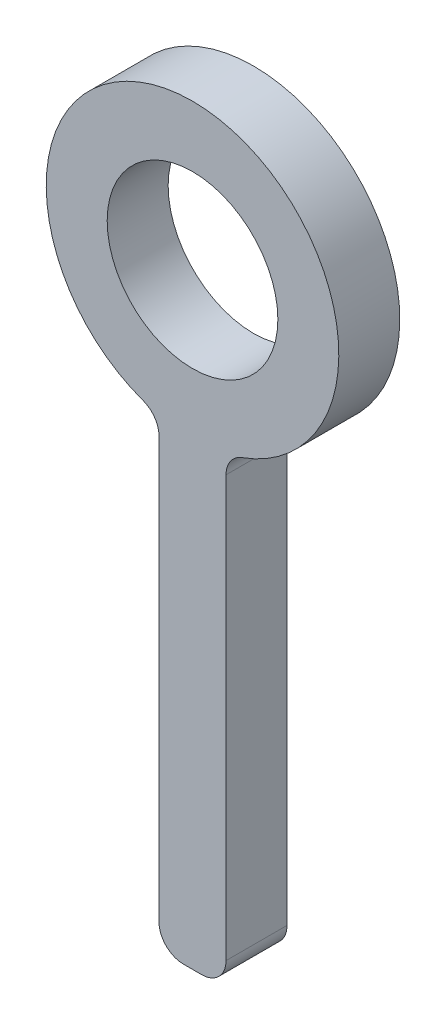
from build123d import *

# Parameters (mm, degrees)
SKETCH1_R           = 7
BOSS_EXTRUDE1_DEPTH = 5
FILLET1_R           = 2


with BuildPart() as part:
    # Sketch1 → Boss-Extrude1 (new body)
    with BuildSketch(Plane.XY):
        with BuildLine():
            Line((0, 0), (0, -38))
            Line((0, -38), (5.5, -38))
            Line((5.5, -38), (5.5, 0))
            ThreePointArc((5.5, 0), (2.75, 23.680646386), (0, 0))
        make_face()
        with Locations((2.75, 11.680646386)):
            Circle(SKETCH1_R, mode=Mode.SUBTRACT)
    extrude(amount=BOSS_EXTRUDE1_DEPTH)

    # Fillet1
    fillet1_edges = [part.edges().sort_by_distance(p)[0] for p in [
        (5.5, 0, 2.5),
        (5.5, -38, 2.5),
        (0, -38, 2.5),
        (0, 0, 2.5),
    ]]
    fillet(fillet1_edges, radius=FILLET1_R)


solid = part.part
